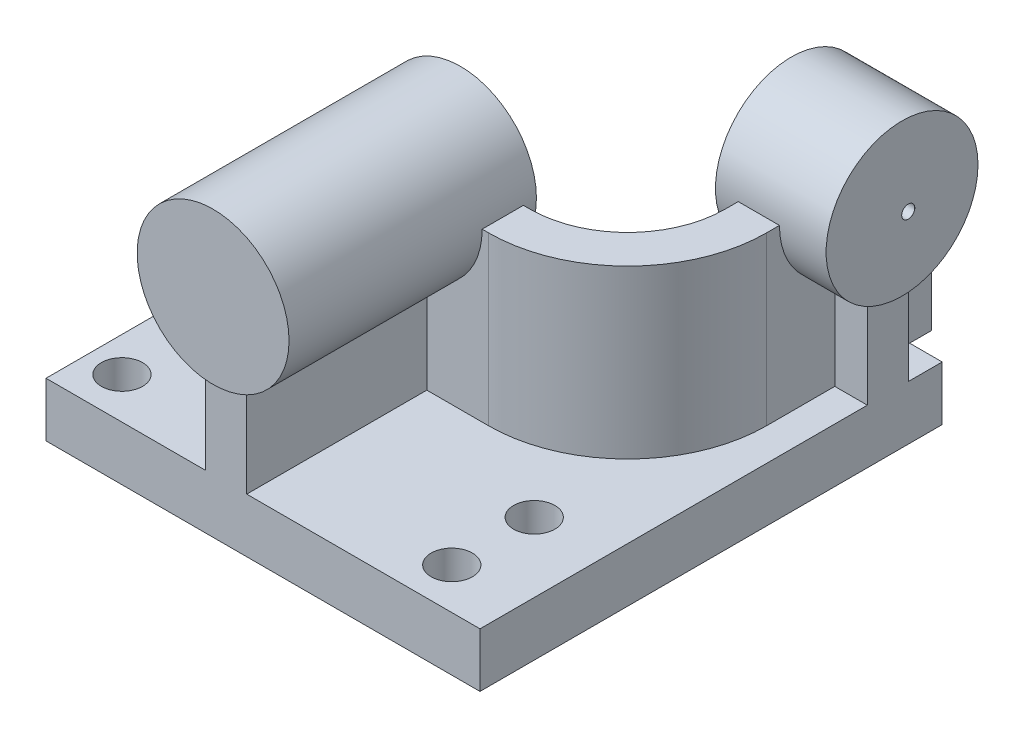
from build123d import *

# Parameters (mm, degrees)
SKETCH1_R                       = 9.5
BOSS_EXTRUDE1_DEPTH             = 25
BOSS_EXTRUDE2_DEPTH             = 6
BOSS_EXTRUDE2_DEPTH_BACK        = 108
SKETCH2_R                       = 35
BOSS_EXTRUDE3_DEPTH             = 6.5
BOSS_EXTRUDE3_DEPTH_BACK        = 44.5
SKETCH3_R                       = 35
BOSS_EXTRUDE4_DEPTH             = 77
RIB1_REACH                      = 331.39
SKETCH5_WALLS_W                 = 19
SKETCH5_WALLS_H                 = 685.704980613
RIB2_REACH                      = 335.377
SKETCH6_WALLS_W                 = 19
SKETCH6_WALLS_H                 = 696.792690098
F_6_0MM_DOWEL_HOLE1_D           = 6
F_6_0MM_DOWEL_HOLE1_DEPTH       = 54
F_6_0MM_DOWEL_HOLE1_CSINK_D     = 6.05
F_6_0MM_DOWEL_HOLE1_CSINK_ANGLE = 90
F_6_0MM_DOWEL_HOLE1_TIP         = 1.802581857


with BuildPart() as part:
    # Sketch1 → Boss-Extrude1 (new body)
    with BuildSketch(Plane(origin=(0, 0, 0), x_dir=(1, 0, 0), z_dir=(0, 1, 0))):
        with BuildLine():
            Line((0, 102), (0, 0))
            Line((0, 0), (200, 0))
            Line((200, 0), (200, 213))
            Line((200, 213), (166, 213))
            Line((166, 213), (166, 147))
            ThreePointArc((166, 147), (152.819805153, 115.180194847), (121, 102))
            Line((121, 102), (0, 102))
        make_face()
        with Locations(Location((16, 57, 0), (0, 0, 270))):
            Circle(SKETCH1_R, mode=Mode.SUBTRACT)
        with Locations(Location((16, 19, 0), (0, 0, 270))):
            Circle(SKETCH1_R, mode=Mode.SUBTRACT)
        with Locations(Location((168, 19, 0), (0, 0, 270))):
            Circle(SKETCH1_R, mode=Mode.SUBTRACT)
        with Locations(Location((168, 57, 0), (0, 0, 270))):
            Circle(SKETCH1_R, mode=Mode.SUBTRACT)
    extrude(amount=BOSS_EXTRUDE1_DEPTH)



with BuildPart() as body_2:
    # Sketch2 → Boss-Extrude2 (new, two sides: drawn at the far end of the back side and taken through both)
    with BuildSketch(Plane.XY.offset(-BOSS_EXTRUDE2_DEPTH_BACK)):
        with Locations((83, 102)):
            Circle(SKETCH2_R)
    extrude(amount=BOSS_EXTRUDE2_DEPTH + BOSS_EXTRUDE2_DEPTH_BACK)


with BuildPart() as body_3:
    # Sketch3 → Boss-Extrude3 (new, two sides: drawn at the far end of the back side and taken through both)
    with BuildSketch(Plane(origin=(200, 0, 0), x_dir=(0, 0, -1), z_dir=(1, 0, 0)).offset(-BOSS_EXTRUDE3_DEPTH_BACK)):
        with Locations((188, 102)):
            Circle(SKETCH3_R)
    extrude(amount=BOSS_EXTRUDE3_DEPTH + BOSS_EXTRUDE3_DEPTH_BACK)


with BuildPart() as part_1:
    add(part.part)

    add(body_2.part)  # Boss-Extrude4 merges body 2

    add(body_3.part)  # Boss-Extrude4 merges body 3
    # Sketch4 → Boss-Extrude4 (add)
    with BuildSketch(Plane(origin=(0, 25, 0), x_dir=(1, 0, 0), z_dir=(0, 1, 0))):
        with BuildLine():
            Line((121, 102), (48, 102))
            Line((48, 102), (48, 83))
            Line((48, 83), (121, 83))
            ThreePointArc((121, 83), (166.254833996, 101.745166004), (185, 147))
            Line((185, 147), (185, 223))
            Line((185, 223), (166, 223))
            Line((166, 223), (166, 147))
            ThreePointArc((166, 147), (152.819805153, 115.180194847), (121, 102))
        make_face()
    extrude(amount=BOSS_EXTRUDE4_DEPTH)

    # Sketch5 walls → Rib1 (add, up to next)
    with BuildSketch(Plane(origin=(200, 0, 0), x_dir=(0, 0, -1), z_dir=(1, 0, 0)), mode=Mode.PRIVATE) as rib1_sk1:
        with Locations((188, 47.27733831)):
            Rectangle(SKETCH5_WALLS_W, SKETCH5_WALLS_H)
    rib1_tool1 = extrude(rib1_sk1.sketch, amount=-RIB1_REACH, mode=Mode.PRIVATE) - part_1.part
    add(rib1_tool1.solids().sort_by_distance((200, 47.277338311, -188))[0])

    # Sketch6 walls → Rib2 (add, up to next)
    with BuildSketch(Plane.XY, mode=Mode.PRIVATE) as rib2_sk1:
        with Locations((83, 44.133110569)):
            Rectangle(SKETCH6_WALLS_W, SKETCH6_WALLS_H)
    rib2_tool1 = extrude(rib2_sk1.sketch, amount=-RIB2_REACH, mode=Mode.PRIVATE) - part_1.part
    add(rib2_tool1.solids().sort_by_distance((83, 44.133110569, 0))[0])

    # Ø6.0mm Dowel Hole1
    with Locations(Plane(origin=(206.5, 99.319699539, -190.863289795), x_dir=(0, 0, 1), z_dir=(1, 0, 0))):
        with Locations((0, 0)):
            CounterSinkHole(F_6_0MM_DOWEL_HOLE1_D / 2, F_6_0MM_DOWEL_HOLE1_CSINK_D / 2, depth=F_6_0MM_DOWEL_HOLE1_DEPTH, counter_sink_angle=F_6_0MM_DOWEL_HOLE1_CSINK_ANGLE)
            with Locations((0, 0, -(F_6_0MM_DOWEL_HOLE1_DEPTH + F_6_0MM_DOWEL_HOLE1_TIP / 2))):  # 118° drill point
                Cone(0, F_6_0MM_DOWEL_HOLE1_D / 2, F_6_0MM_DOWEL_HOLE1_TIP, mode=Mode.SUBTRACT)


solid = part_1.part
